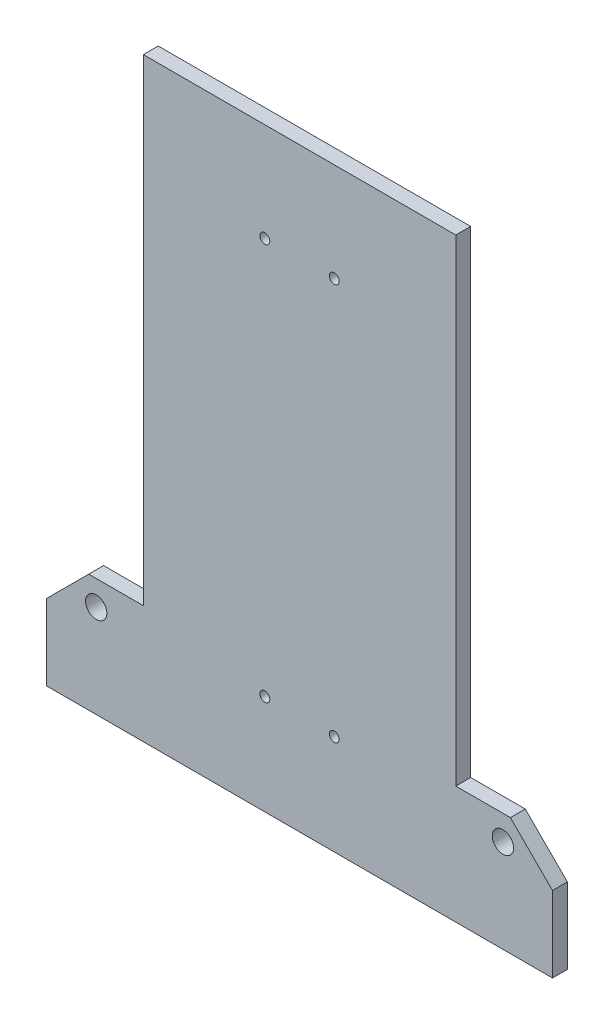
from build123d import *

# Parameters (mm, degrees)
EXTRUDE_1_DEPTH     = 3
SKETCH_2_R          = 2.15
CUT_EXTRUDE_1_DEPTH = 3
SKETCH_3_R          = 1
CUT_EXTRUDE_2_DEPTH = 70
CUT_EXTRUDE1_DEPTH  = 10


with BuildPart() as part:
    # 草图1 → 凸台-拉伸1 (new body)
    with BuildSketch(Plane.XY):
        Polygon((-51.0025, -68.891882816), (51.0025, -68.891882816), (51.0025, 35.266689181), (40.10963441, 51.108117184), (-37.096440595, 51.108117184), (-51.0025, 41.546047656), align=None)
    extrude(amount=-EXTRUDE_1_DEPTH)

    # 草图2 → 切除-拉伸1 (cut)
    with BuildSketch(Plane.XY):
        with Locations((-41.0025, 9.872461287)):
            Circle(SKETCH_2_R)
        with Locations((-41.0025, -50.127538712)):
            Circle(SKETCH_2_R)
        with Locations((41.0025, 9.872461287)):
            Circle(SKETCH_2_R)
        with Locations((41.0025, -50.127538712)):
            Circle(SKETCH_2_R)
    extrude(amount=-CUT_EXTRUDE_1_DEPTH, mode=Mode.SUBTRACT)

    # 草图3 → 切除-拉伸2 (cut)
    with BuildSketch(Plane(origin=(0, 0, -3), x_dir=(-1, 0, 0), z_dir=(0, 0, -1))):
        with Locations((-7.000166, 31.25)):
            Circle(SKETCH_3_R)
        with Locations((6.999834, 31.25)):
            Circle(SKETCH_3_R)
        with Locations((-7.000166, -48.75)):
            Circle(SKETCH_3_R)
        with Locations((6.999834, -48.75)):
            Circle(SKETCH_3_R)
    extrude(amount=-CUT_EXTRUDE_2_DEPTH, mode=Mode.SUBTRACT)

    # Sketch1 → Cut-Extrude1 (cut)
    with BuildSketch(Plane.XY):
        Polygon((51.0025, -53.612820087), (42.517218626, -45.127538713), (31.499996481, -45.127538713), (31.499964702, 63.629107338), (51.0025, 63.629107338), align=None)
        Polygon((-31.499999356, -45.127538713), (-42.517218626, -45.127538713), (-51.0025, -53.612820087), (-51.0025, 54.95635915), (-31.499965771, 54.95635915), align=None)
    extrude(amount=-CUT_EXTRUDE1_DEPTH, mode=Mode.SUBTRACT)


solid = part.part
